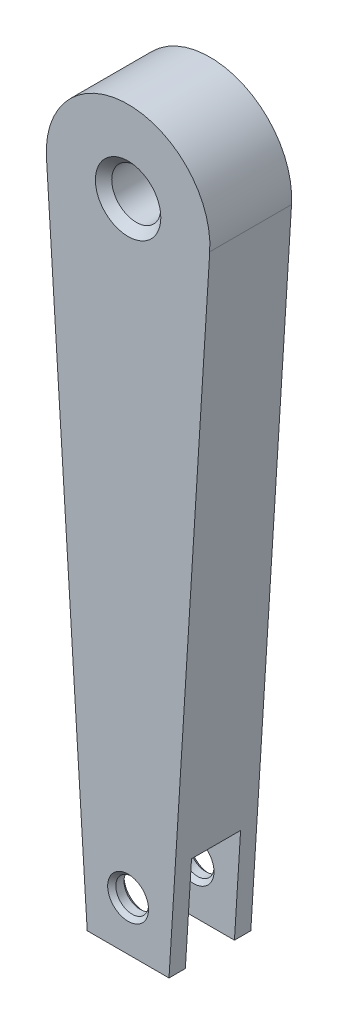
from build123d import *

# Parameters (mm, degrees)
SKETCH_1_R               = 10
EXTRUDE_1_DEPTH          = 10
EXTRUDE_2_DEPTH          = 10
CUT_EXTRUDE_2_DEPTH      = 81.925892025
CUT_EXTRUDE_2_DEPTH_BACK = 81.925892025
SKETCH_3_R               = 3
CUT_EXTRUDE_3_DEPTH      = 82.240384046
CUT_EXTRUDE_3_DEPTH_BACK = 82.240384046
SKETCH_7_W               = 6
SKETCH_7_H               = 16
CUT_EXTRUDE_4_DEPTH      = 82.240384046
CUT_EXTRUDE_4_DEPTH_BACK = 82.240384046
SKETCH_8_R               = 2
CHAMFER_1_SIZE           = 1
CHAMFER_2_SIZE           = 0.5


with BuildPart() as part:
    # 草图1 → 凸台-拉伸1 (new body)
    with BuildSketch(Plane.XY):
        Circle(SKETCH_1_R)
    extrude(amount=EXTRUDE_1_DEPTH)

    # 草图2 → 凸台-拉伸2 (add)
    with BuildSketch(Plane.XY):
        with BuildLine():
            Line((-9.980372744, -0.626226703), (-5, -80))
            Line((-5, -80), (5, -80))
            Line((5, -80), (9.980372744, -0.626226703))
            ThreePointArc((9.980372744, -0.626226703), (0, -10), (-9.980372744, -0.626226703))
        make_face()
    extrude(amount=EXTRUDE_2_DEPTH)

    # 草图3 → 切除-拉伸2 (cut, two sides: drawn at the far end of the back side and taken through both)
    with BuildSketch(Plane(origin=(0, 0, 3), x_dir=(-1, 0, 0), z_dir=(0, 0, -1)).offset(-CUT_EXTRUDE_2_DEPTH_BACK)):
        Circle(SKETCH_3_R)
    extrude(amount=CUT_EXTRUDE_2_DEPTH + CUT_EXTRUDE_2_DEPTH_BACK, mode=Mode.SUBTRACT)

    # 草图7 → 切除-拉伸3 (cut, two sides: drawn at the far end of the back side and taken through both)
    with BuildSketch(Plane(origin=(0, 0, 0), x_dir=(0, 0, -1), z_dir=(1, 0, 0)).offset(-CUT_EXTRUDE_3_DEPTH_BACK)):
        with Locations((-5, -76)):
            Rectangle(SKETCH_7_W, SKETCH_7_H)
    extrude(amount=CUT_EXTRUDE_3_DEPTH + CUT_EXTRUDE_3_DEPTH_BACK, mode=Mode.SUBTRACT)

    # 草图8 → 切除-拉伸4 (cut, two sides: drawn at the far end of the back side and taken through both)
    with BuildSketch(Plane.XY.offset(10).offset(-CUT_EXTRUDE_4_DEPTH_BACK)):
        with Locations((0, -74)):
            Circle(SKETCH_8_R)
    extrude(amount=CUT_EXTRUDE_4_DEPTH + CUT_EXTRUDE_4_DEPTH_BACK, mode=Mode.SUBTRACT)

    # 倒角1
    chamfer_1_edges = [part.edges().sort_by_distance(p)[0] for p in [
        (3, 0, 10),
    ]]
    chamfer(chamfer_1_edges, length=CHAMFER_1_SIZE)

    # 倒角2
    chamfer_2_edges = [part.edges().sort_by_distance(p)[0] for p in [
        (-2, -74, 10),
        (-2, -74, 8),
        (-2, -74, 0),
        (-2, -74, 2),
    ]]
    chamfer(chamfer_2_edges, length=CHAMFER_2_SIZE)


solid = part.part
